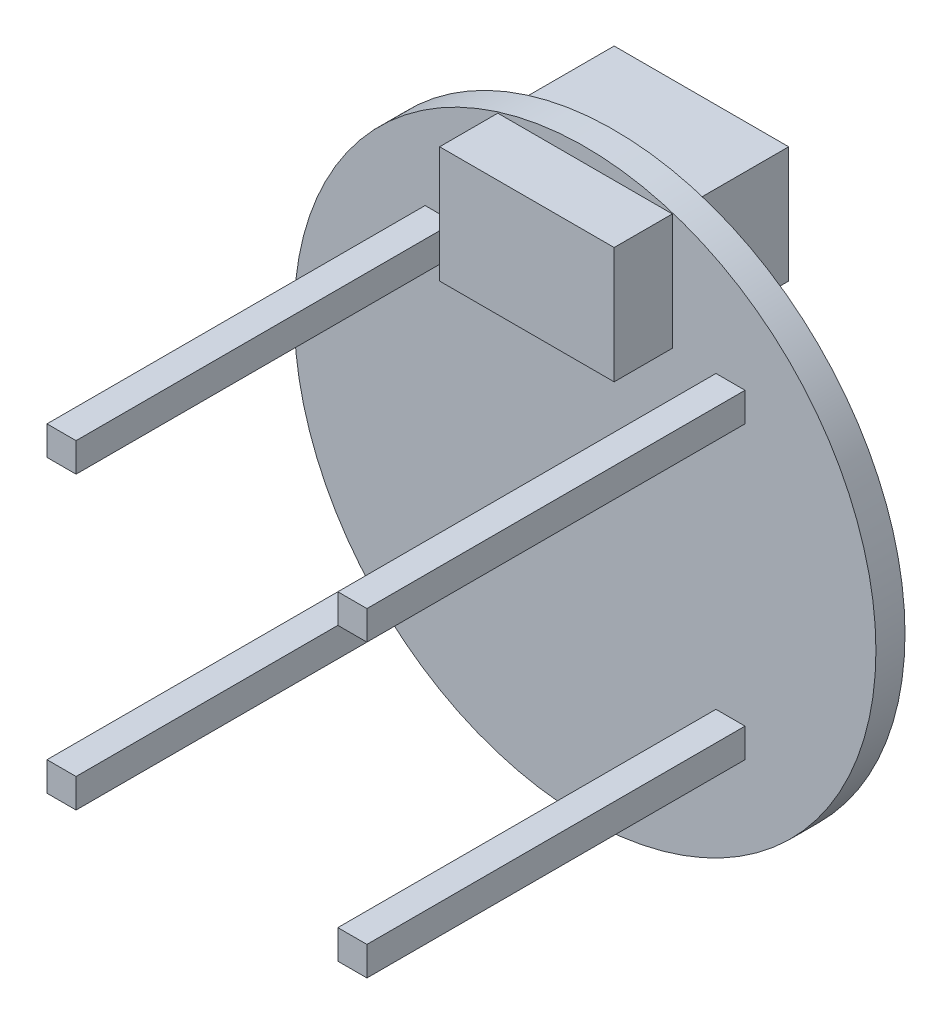
from build123d import *

# Parameters (mm, degrees)
SKETCH_1_R      = 500
EXTRUDE_1_DEPTH = 50
SKETCH_2_W      = 50
SKETCH_2_H      = 50
EXTRUDE_2_DEPTH = 700
SKETCH_3_W      = 50
SKETCH_3_H      = 50
EXTRUDE_3_DEPTH = 700
SKETCH_4_W      = 50
SKETCH_4_H      = 50
EXTRUDE_4_DEPTH = 700
SKETCH_5_W      = 50
SKETCH_5_H      = 50
EXTRUDE_5_DEPTH = 700
SKETCH_6_W      = 300
SKETCH_6_H      = 300
EXTRUDE_6_DEPTH = 200


with BuildPart() as part:
    # 草图1 → 凸台-拉伸1 (new body)
    with BuildSketch(Plane.XY):
        Circle(SKETCH_1_R)
    extrude(amount=EXTRUDE_1_DEPTH)

    # 草图2 → 凸台-拉伸2 (add)
    with BuildSketch(Plane.XY):
        with Locations((250, 250)):
            Rectangle(SKETCH_2_W, SKETCH_2_H)
    extrude(amount=EXTRUDE_2_DEPTH)

    # 草图3 → 凸台-拉伸3 (add)
    with BuildSketch(Plane.XY):
        with Locations((-250, 250)):
            Rectangle(SKETCH_3_W, SKETCH_3_H)
    extrude(amount=EXTRUDE_3_DEPTH)

    # 草图4 → 凸台-拉伸4 (add)
    with BuildSketch(Plane.XY):
        with Locations((250, -250)):
            Rectangle(SKETCH_4_W, SKETCH_4_H)
    extrude(amount=EXTRUDE_4_DEPTH)

    # 草图5 → 凸台-拉伸5 (add)
    with BuildSketch(Plane.XY):
        with Locations((-250, -250)):
            Rectangle(SKETCH_5_W, SKETCH_5_H)
    extrude(amount=EXTRUDE_5_DEPTH)

    # 草图6 → 凸台-拉伸6 (add)
    with BuildSketch(Plane(origin=(0, 275, 0), x_dir=(1, 0, 0), z_dir=(0, 1, 0))):
        Rectangle(SKETCH_6_W, SKETCH_6_H)
    extrude(amount=EXTRUDE_6_DEPTH)


solid = part.part
